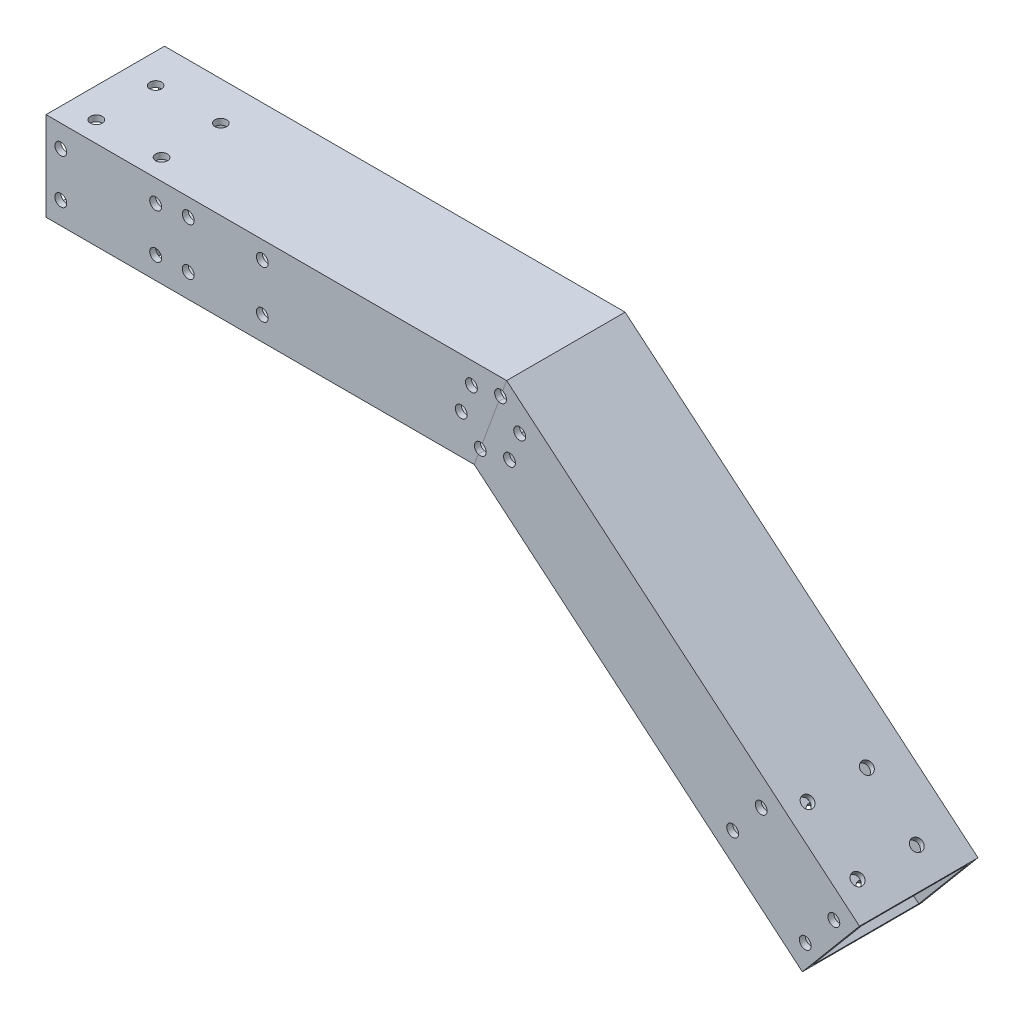
from build123d import *

# Parameters (mm, degrees)
SKETCH1_ON_SEGMENT_1_W       = 30
SKETCH1_ON_SEGMENT_1_H       = 40
SKETCH1_ON_SEGMENT_1_W_2     = 26
SKETCH1_ON_SEGMENT_1_H_2     = 36
F_20_X_20_X_2_1_DEPTH        = 160.099255857
F_20_X_20_X_2_1_2_DEPTH      = 150
F_20_X_20_X_2_1_2_DEPTH_BACK = 10.099255857
SKETCH1_W                    = 30
SKETCH1_H                    = 40
SKETCH1_W_2                  = 26
SKETCH1_H_2                  = 36
SKETCH_2_R                   = 2
CUT_EXTRUDE_1_DEPTH          = 190.061658897
SKETCH_3_R                   = 2
CUT_EXTRUDE_2_DEPTH          = 195.952750962
SKETCH_4_R                   = 2
CUT_EXTRUDE_3_DEPTH          = 201.354045112
SKETCH_5_R                   = 2
CUT_EXTRUDE_4_DEPTH          = 190.061658897
SKETCH_6_R                   = 2
CUT_EXTRUDE_5_DEPTH          = 190.061658897
SKETCH_7_R                   = 2
CUT_EXTRUDE_6_DEPTH          = 190.061658897


with BuildPart() as part:
    # Sketch1 on segment 1 (carried to segment 1) → 方形管 20 X 20 X 2(1) (new body)
    with BuildSketch(Plane(origin=(114.906666468, -96.418141453, 0), x_dir=(-0.64278761, -0.766044443, 0), z_dir=(-0.766044443, 0.64278761, 0))):
        Rectangle(SKETCH1_ON_SEGMENT_1_W, SKETCH1_ON_SEGMENT_1_H)
        Rectangle(SKETCH1_ON_SEGMENT_1_W_2, SKETCH1_ON_SEGMENT_1_H_2, mode=Mode.SUBTRACT)
    extrude(amount=F_20_X_20_X_2_1_DEPTH)

    # 方形管 20 X 20 X 2(1) mitre 1
    split(bisect_by=Plane(origin=(0, 0, 0), x_dir=(0.342020143, 0.939692621, 0), z_dir=(0.939692621, -0.342020143, 0)), keep=Keep.TOP)


with BuildPart() as body_2:
    # Sketch1 → 20 X 20 X 2_1 2 (new, two sides: drawn at the far end of the back side and taken through both)
    with BuildSketch(Plane(origin=(0, 0, 0), x_dir=(0, -1, 0), z_dir=(-1, 0, 0)).offset(-F_20_X_20_X_2_1_2_DEPTH_BACK)):
        Rectangle(SKETCH1_W, SKETCH1_H)
        Rectangle(SKETCH1_W_2, SKETCH1_H_2, mode=Mode.SUBTRACT)
    extrude(amount=F_20_X_20_X_2_1_2_DEPTH + F_20_X_20_X_2_1_2_DEPTH_BACK)

    # 20 X 20 X 2_1 2 mitre 1
    split(bisect_by=Plane(origin=(0, 0, 0), x_dir=(-0.342020143, -0.939692621, 0), z_dir=(-0.939692621, 0.342020143, 0)), keep=Keep.TOP)


with BuildPart() as cut_extrude_1_tool:
    # 草图2 → 切除-拉伸1 (new, through all)
    with BuildSketch(Plane.XY.offset(20)):
        with Locations((3.421850348, 9.401456565)):
            Circle(SKETCH_2_R)
        with Locations((9.852825392, 1.737318953)):
            Circle(SKETCH_2_R)
        with Locations((6.430975043, -7.664137612)):
            Circle(SKETCH_2_R)
        with Locations((-3.421850348, -9.401456565)):
            Circle(SKETCH_2_R)
        with Locations((-9.852825392, -1.737318953)):
            Circle(SKETCH_2_R)
        with Locations((-6.430975043, 7.664137612)):
            Circle(SKETCH_2_R)
    extrude(amount=-CUT_EXTRUDE_1_DEPTH)


with BuildPart() as part_1:
    add(part.part)

    # 切除-拉伸1: cut by cut_extrude_1_tool
    add(cut_extrude_1_tool.part, mode=Mode.SUBTRACT)

    # 草图4 → 切除-拉伸3 (cut, through all)
    with BuildSketch(Plane(origin=(9.641814145, 11.490666647, 0), x_dir=(0.7660444431189819, -0.6427876096865346, 0), z_dir=(0.6427876096865347, 0.766044443118982, 0))):
        with Locations(Location((118, -13, 0), (0, 0, 180))):
            Circle(SKETCH_4_R)
        with Locations(Location((118, 7, 0), (0, 0, 180))):
            Circle(SKETCH_4_R)
        with Locations(Location((140, 7, 0), (0, 0, 180))):
            Circle(SKETCH_4_R)
        with Locations(Location((140, -13, 0), (0, 0, 180))):
            Circle(SKETCH_4_R)
    extrude(amount=-CUT_EXTRUDE_3_DEPTH, mode=Mode.SUBTRACT)

    # 草图7 → 切除-拉伸6 (cut, through all)
    with BuildSketch(Plane.XY.offset(20)):
        with Locations((115.897351325, -87.458870081)):
            Circle(SKETCH_7_R)
        with Locations((106.25553718, -98.949536728)):
            Circle(SKETCH_7_R)
        with Locations((81.742115, -78.380333218)):
            Circle(SKETCH_7_R)
        with Locations((91.383929145, -66.889666571)):
            Circle(SKETCH_7_R)
    extrude(amount=-CUT_EXTRUDE_6_DEPTH, mode=Mode.SUBTRACT)


with BuildPart() as body_2_1:
    add(body_2.part)

    # 切除-拉伸1: cut by cut_extrude_1_tool
    add(cut_extrude_1_tool.part, mode=Mode.SUBTRACT)

    # 草图3 → 切除-拉伸2 (cut, through all)
    with BuildSketch(Plane(origin=(0, 15, 0), x_dir=(1, 0, 0), z_dir=(0, 1, 0))):
        with Locations(Location((-118, 7, 0), (0, 0, 270))):
            Circle(SKETCH_3_R)
        with Locations(Location((-118, -13, 0), (0, 0, 270))):
            Circle(SKETCH_3_R)
        with Locations(Location((-140, -13, 0), (0, 0, 270))):
            Circle(SKETCH_3_R)
        with Locations(Location((-140, 7, 0), (0, 0, 270))):
            Circle(SKETCH_3_R)
    extrude(amount=-CUT_EXTRUDE_2_DEPTH, mode=Mode.SUBTRACT)

    # 草图5 → 切除-拉伸4 (cut, through all)
    with BuildSketch(Plane.XY.offset(20)):
        with Locations((-102, 9)):
            Circle(SKETCH_5_R)
        with Locations((-77, 9)):
            Circle(SKETCH_5_R)
        with Locations((-102, -7)):
            Circle(SKETCH_5_R)
        with Locations((-77, -7)):
            Circle(SKETCH_5_R)
    extrude(amount=-CUT_EXTRUDE_4_DEPTH, mode=Mode.SUBTRACT)

    # 草图6 → 切除-拉伸5 (cut, through all)
    with BuildSketch(Plane.XY.offset(20)):
        with Locations((-145, 7.5)):
            Circle(SKETCH_6_R)
        with Locations((-113, 7.5)):
            Circle(SKETCH_6_R)
        with Locations((-113, -7.5)):
            Circle(SKETCH_6_R)
        with Locations((-145, -7.5)):
            Circle(SKETCH_6_R)
    extrude(amount=-CUT_EXTRUDE_5_DEPTH, mode=Mode.SUBTRACT)


solid = Compound([part_1.part, body_2_1.part])
